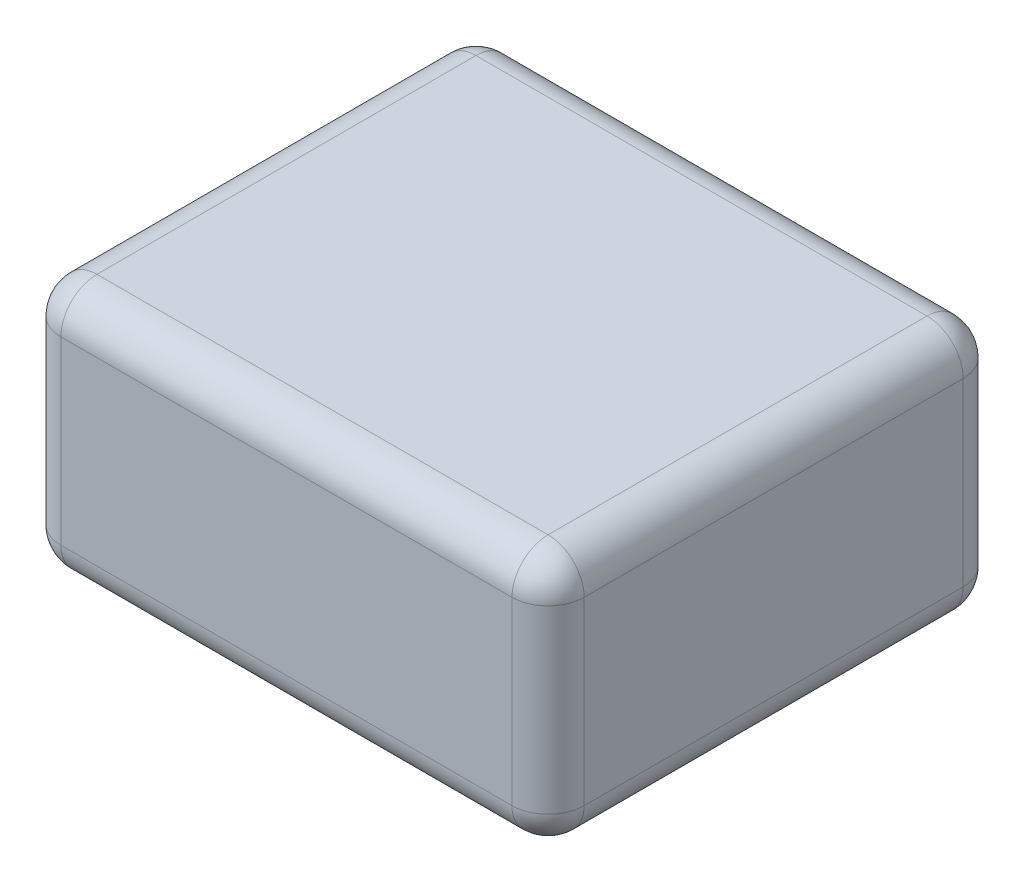
from build123d import *

# Parameters (mm, degrees)
SKETCH1_W           = 184.15
SKETCH1_H           = 158.75
BOSS_EXTRUDE1_DEPTH = 88.9
FILLET1_R           = 12.7


with BuildPart() as part:
    # Sketch1 → Boss-Extrude1 (new body)
    with BuildSketch(Plane(origin=(0, 0, 0), x_dir=(1, 0, 0), z_dir=(0, 1, 0))):
        Rectangle(SKETCH1_W, SKETCH1_H)
    extrude(amount=BOSS_EXTRUDE1_DEPTH)

    # Fillet1
    fillet1_edges = [part.edges().sort_by_distance(p)[0] for p in [
        (-92.075, 0, 0),
        (-92.075, 44.45, -79.375),
        (0, 0, -79.375),
        (92.075, 44.45, -79.375),
        (92.075, 0, 0),
        (-92.075, 88.9, 0),
        (0, 88.9, -79.375),
        (92.075, 88.9, 0),
        (-92.075, 44.45, 79.375),
        (0, 88.9, 79.375),
        (92.075, 44.45, 79.375),
        (0, 0, 79.375),
    ]]
    fillet(fillet1_edges, radius=FILLET1_R)


solid = part.part
